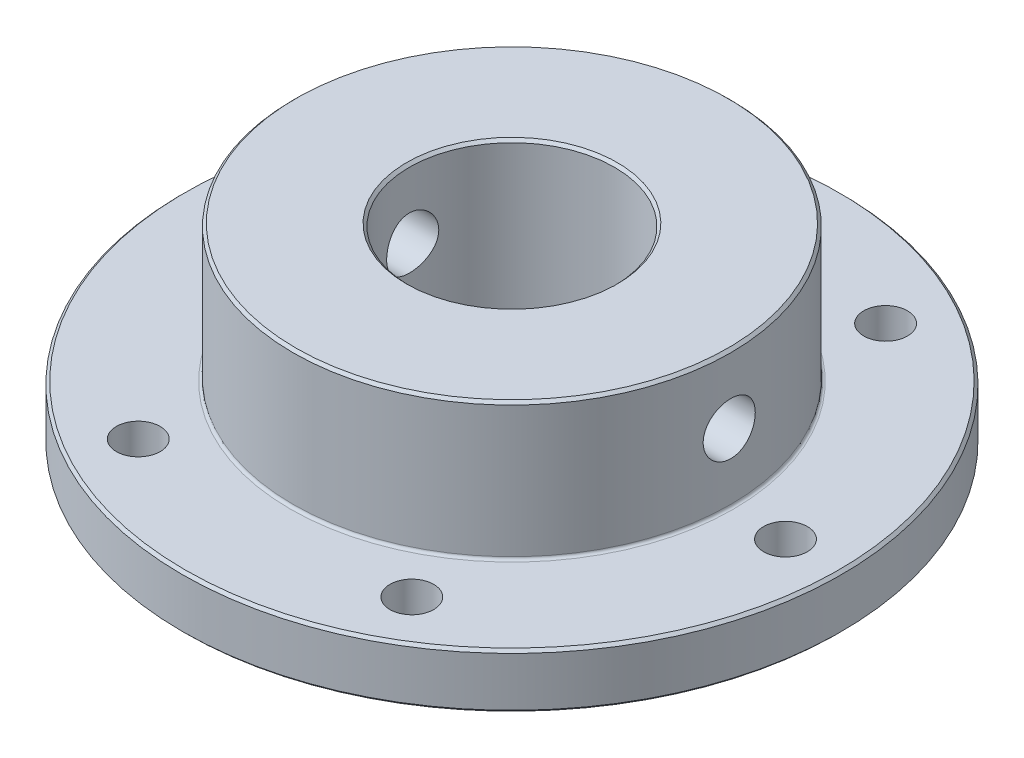
from build123d import *

# Parameters (mm, degrees)
CROQUIS1_R                 = 60.239614391
CROQUIS1_R_2               = 18.75
CROQUIS1_R_3               = 4
SALIENTE_EXTRUIR1_DEPTH    = 10
CROQUIS2_R                 = 40
CROQUIS2_R_2               = 18.75
SALIENTE_EXTRUIR2_DEPTH    = 25
CHAFL_N2_SIZE              = 0.5
REDONDEO1_R                = 0.5
CORTAR_EXTRUIR1_DEPTH      = 93.101152457
CORTAR_EXTRUIR1_DEPTH_BACK = 93.101152457
CROQUIS3_R                 = 4.7625


with BuildPart() as part:
    # Croquis1 → Saliente-Extruir1 (new body)
    with BuildSketch(Plane(origin=(0, 0, 0), x_dir=(1, 0, 0), z_dir=(0, 1, 0))):
        with Locations(Location((0, 0, 0), (0, 0, 270))):
            Circle(CROQUIS1_R)
        with Locations(Location((0, 0, 0), (0, 0, 270))):
            Circle(CROQUIS1_R_2, mode=Mode.SUBTRACT)
        with Locations(Location((25, -43.301270189, 0), (0, 0, 270))):
            Circle(CROQUIS1_R_3, mode=Mode.SUBTRACT)
        with Locations(Location((-25, -43.301270189, 0), (0, 0, 270))):
            Circle(CROQUIS1_R_3, mode=Mode.SUBTRACT)
        with Locations(Location((-50, 0, 0), (0, 0, 270))):
            Circle(CROQUIS1_R_3, mode=Mode.SUBTRACT)
        with Locations(Location((-25, 43.301270189, 0), (0, 0, 270))):
            Circle(CROQUIS1_R_3, mode=Mode.SUBTRACT)
        with Locations(Location((25, 43.301270189, 0), (0, 0, 270))):
            Circle(CROQUIS1_R_3, mode=Mode.SUBTRACT)
        with Locations(Location((50, 0, 0), (0, 0, 270))):
            Circle(CROQUIS1_R_3, mode=Mode.SUBTRACT)
    extrude(amount=SALIENTE_EXTRUIR1_DEPTH)

    # Croquis2 → Saliente-Extruir2 (add)
    with BuildSketch(Plane(origin=(0, 10, 0), x_dir=(1, 0, 0), z_dir=(0, 1, 0))):
        with Locations(Location((0, 0, 0), (0, 0, 270))):
            Circle(CROQUIS2_R)
        with Locations(Location((0, 0, 0), (0, 0, 270))):
            Circle(CROQUIS2_R_2, mode=Mode.SUBTRACT)
    extrude(amount=SALIENTE_EXTRUIR2_DEPTH)

    # Chaflán2
    chafl_n2_edges = [part.edges().sort_by_distance(p)[0] for p in [
        (0, 0, -60.239614391),
        (0, 35, -40),
        (0, 35, -18.75),
        (0, 10, -60.239614391),
    ]]
    chamfer(chafl_n2_edges, length=CHAFL_N2_SIZE)

    # Redondeo1
    redondeo1_edges = [part.edges().sort_by_distance(p)[0] for p in [
        (0, 10, -40),
    ]]
    fillet(redondeo1_edges, radius=REDONDEO1_R)

    # Croquis3 → Cortar-Extruir1 (cut, two sides: drawn at the far end of the back side and taken through both)
    with BuildSketch(Plane(origin=(0, 0, 0), x_dir=(0, 0, -1), z_dir=(1, 0, 0)).offset(-CORTAR_EXTRUIR1_DEPTH_BACK)):
        with Locations((0, 22.5)):
            Circle(CROQUIS3_R)
    extrude(amount=CORTAR_EXTRUIR1_DEPTH + CORTAR_EXTRUIR1_DEPTH_BACK, mode=Mode.SUBTRACT)


solid = part.part
